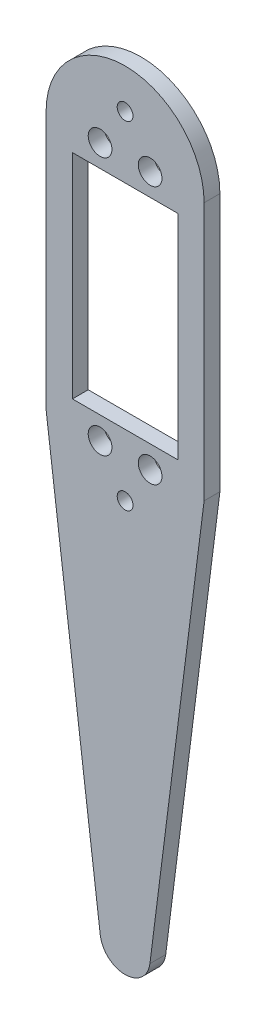
from build123d import *

# Parameters (mm, degrees)
SKETCH1_R           = 2.25
SKETCH1_R_2         = 1.5
SKETCH1_W           = 20
SKETCH1_H           = 40.5
BOSS_EXTRUDE1_DEPTH = 3


with BuildPart() as part:
    # Sketch1 → Boss-Extrude1 (new body)
    with BuildSketch(Plane.XY):
        with BuildLine():
            Line((-5, 44.75), (-5, -4.25))
            Line((-5, -4.25), (5.287636044, -85.486762889))
            ThreePointArc((5.287636044, -85.486762889), (10, -89.64), (14.712363956, -85.486762889))
            Line((14.712363956, -85.486762889), (25, -4.25))
            Line((25, -4.25), (25, 44.75))
            ThreePointArc((25, 44.75), (10, 59.75), (-5, 44.75))
        make_face()
        with Locations((14.75, -4.25)):
            Circle(SKETCH1_R, mode=Mode.SUBTRACT)
        with Locations((5.25, -4.25)):
            Circle(SKETCH1_R, mode=Mode.SUBTRACT)
        with Locations((14.75, 44.75)):
            Circle(SKETCH1_R, mode=Mode.SUBTRACT)
        with Locations((5.25, 44.75)):
            Circle(SKETCH1_R, mode=Mode.SUBTRACT)
        with Locations((10, 52.25)):
            Circle(SKETCH1_R_2, mode=Mode.SUBTRACT)
        with Locations((10, -11.75)):
            Circle(SKETCH1_R_2, mode=Mode.SUBTRACT)
        with Locations((10, 20.25)):
            Rectangle(SKETCH1_W, SKETCH1_H, mode=Mode.SUBTRACT)
    extrude(amount=BOSS_EXTRUDE1_DEPTH)


solid = part.part
